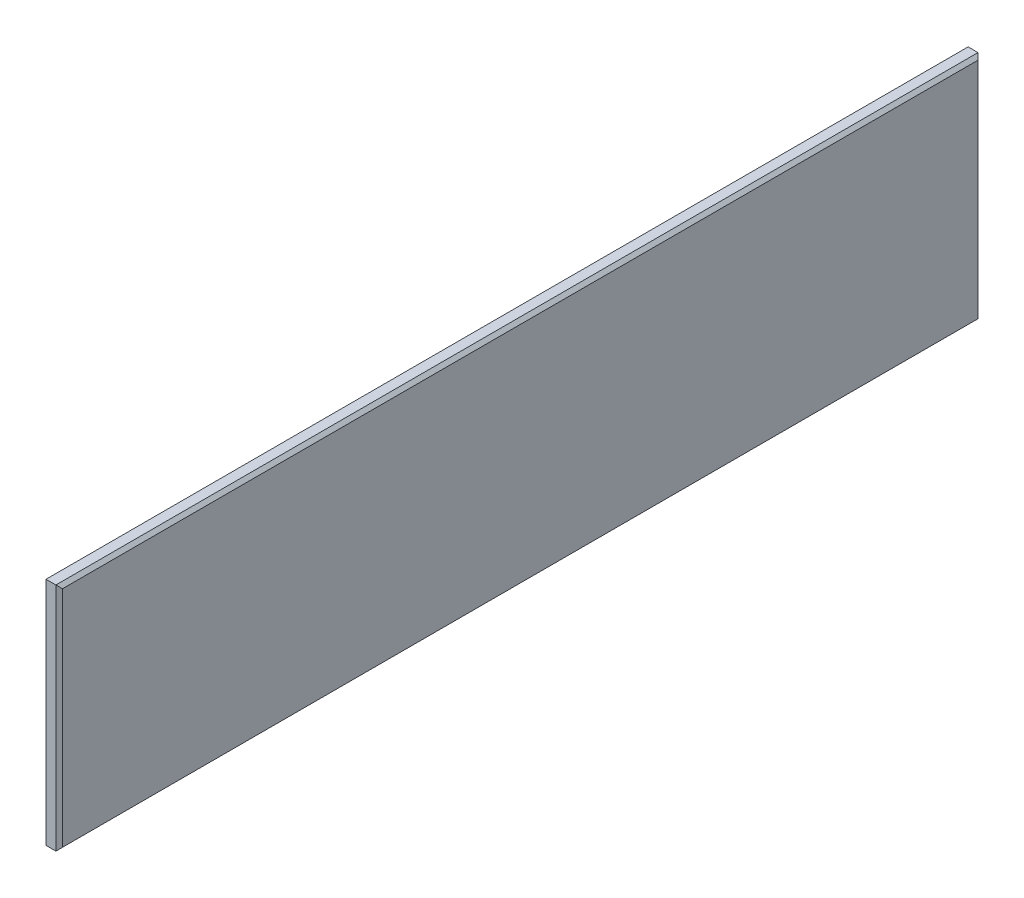
from build123d import *

# Parameters (mm, degrees)
SKETCH1_W           = 5
SKETCH1_H           = 280
BOSS_EXTRUDE1_DEPTH = 70
CHAMFER2_SIZE       = 1


with BuildPart() as part:
    # Sketch1 → Boss-Extrude1 (new body)
    with BuildSketch(Plane(origin=(0, 0, 0), x_dir=(1, 0, 0), z_dir=(0, 1, 0))):
        with Locations((2.5, 140)):
            Rectangle(SKETCH1_W, SKETCH1_H)
    extrude(amount=BOSS_EXTRUDE1_DEPTH)

    # Chamfer2
    chamfer2_edges = [part.edges().sort_by_distance(p)[0] for p in [
        (5, 70, -140),
        (0, 70, -140),
        (5, 0, -140),
        (0, 0, -140),
        (0, 35, -280),
        (5, 35, -280),
        (5, 35, 0),
        (0, 35, 0),
    ]]
    chamfer(chamfer2_edges, length=CHAMFER2_SIZE)


solid = part.part
